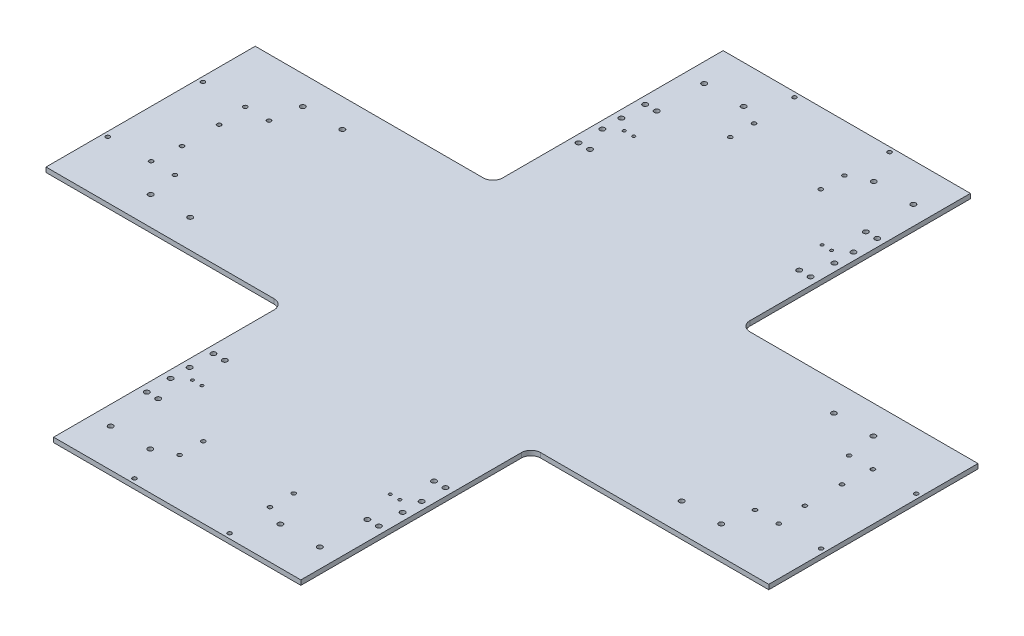
from build123d import *

# Parameters (mm, degrees)
BOSS_EXTRUDE1_DEPTH = 5
SKETCH2_R           = 2.125
CUT_EXTRUDE1_DEPTH  = 3
SKETCH4_R           = 2.6
SKETCH4_R_2         = 1.6
CUT_EXTRUDE3_DEPTH  = 10
SKETCH5_R           = 2.1
CUT_EXTRUDE4_DEPTH  = 10
FILLET1_R           = 10
SKETCH6_R           = 2.6
CUT_EXTRUDE5_DEPTH  = 10


with BuildPart() as part:
    # Sketch1 → Boss-Extrude1 (new body)
    with BuildSketch(Plane(origin=(0, 0, 0), x_dir=(1, 0, 0), z_dir=(0, 1, 0))):
        Polygon((130, 352), (-130, 352), (-130, 110), (-380, 110), (-380, -110), (-130, -110), (-130, -352), (130, -352), (130, -110), (380, -110), (380, 110), (130, 110), align=None)
    extrude(amount=BOSS_EXTRUDE1_DEPTH)

    # Sketch2 → Cut-Extrude1 (cut)
    with BuildSketch(Plane(origin=(0, 5, 0), x_dir=(1, 0, 0), z_dir=(0, 1, 0))):
        with Locations(Location((330, 49.5, 0), (0, 0, 270))):
            Circle(SKETCH2_R)
        with Locations(Location((305, 49.5, 0), (0, 0, 270))):
            Circle(SKETCH2_R)
        with Locations(Location((327.5, 19.5, 0), (0, 0, 270))):
            Circle(SKETCH2_R)
        with Locations(Location((327.5, -19.5, 0), (0, 0, 90))):
            Circle(SKETCH2_R)
        with Locations(Location((305, -49.5, 0), (0, 0, 90))):
            Circle(SKETCH2_R)
        with Locations(Location((330, -49.5, 0), (0, 0, 90))):
            Circle(SKETCH2_R)
        with Locations(Location((-330, -49.5, 0), (0, 0, 270))):
            Circle(SKETCH2_R)
        with Locations(Location((-305, -49.5, 0), (0, 0, 270))):
            Circle(SKETCH2_R)
        with Locations(Location((-327.5, -19.5, 0), (0, 0, 270))):
            Circle(SKETCH2_R)
        with Locations(Location((-327.5, 19.5, 0), (0, 0, 90))):
            Circle(SKETCH2_R)
        with Locations(Location((-305, 49.5, 0), (0, 0, 90))):
            Circle(SKETCH2_R)
        with Locations(Location((-330, 49.5, 0), (0, 0, 90))):
            Circle(SKETCH2_R)
        with Locations(Location((47.5, 302, 0), (0, 0, 270))):
            Circle(SKETCH2_R)
        with Locations(Location((47.5, 277, 0), (0, 0, 270))):
            Circle(SKETCH2_R)
        with Locations(Location((-47.5, 277, 0), (0, 0, 90))):
            Circle(SKETCH2_R)
        with Locations(Location((-47.5, 302, 0), (0, 0, 90))):
            Circle(SKETCH2_R)
        with Locations(Location((-47.5, -302, 0), (0, 0, 270))):
            Circle(SKETCH2_R)
        with Locations(Location((-47.5, -277, 0), (0, 0, 270))):
            Circle(SKETCH2_R)
        with Locations(Location((47.5, -277, 0), (0, 0, 90))):
            Circle(SKETCH2_R)
        with Locations(Location((47.5, -302, 0), (0, 0, 90))):
            Circle(SKETCH2_R)
    extrude(amount=-CUT_EXTRUDE1_DEPTH, mode=Mode.SUBTRACT)

    # Sketch4 → Cut-Extrude3 (cut)
    with BuildSketch(Plane(origin=(0, 5, 0), x_dir=(1, 0, 0), z_dir=(0, 1, 0))):
        with Locations(Location((-122, 192, 0), (0, 0, 270))):
            Circle(SKETCH4_R)
        with Locations(Location((-110, 192, 0), (0, 0, 270))):
            Circle(SKETCH4_R)
        with Locations(Location((-122, 217, 0), (0, 0, 270))):
            Circle(SKETCH4_R)
        with Locations(Location((-122, 237, 0), (0, 0, 270))):
            Circle(SKETCH4_R)
        with Locations(Location((-122, 262, 0), (0, 0, 270))):
            Circle(SKETCH4_R)
        with Locations(Location((-110, 262, 0), (0, 0, 270))):
            Circle(SKETCH4_R)
        with Locations(Location((110, 262, 0), (0, 0, 90))):
            Circle(SKETCH4_R)
        with Locations(Location((122, 262, 0), (0, 0, 90))):
            Circle(SKETCH4_R)
        with Locations(Location((122, 237, 0), (0, 0, 90))):
            Circle(SKETCH4_R)
        with Locations(Location((122, 217, 0), (0, 0, 90))):
            Circle(SKETCH4_R)
        with Locations(Location((110, 192, 0), (0, 0, 90))):
            Circle(SKETCH4_R)
        with Locations(Location((122, 192, 0), (0, 0, 90))):
            Circle(SKETCH4_R)
        with Locations(Location((122, -192, 0), (0, 0, 270))):
            Circle(SKETCH4_R)
        with Locations(Location((110, -192, 0), (0, 0, 270))):
            Circle(SKETCH4_R)
        with Locations(Location((122, -217, 0), (0, 0, 270))):
            Circle(SKETCH4_R)
        with Locations(Location((122, -237, 0), (0, 0, 270))):
            Circle(SKETCH4_R)
        with Locations(Location((122, -262, 0), (0, 0, 270))):
            Circle(SKETCH4_R)
        with Locations(Location((110, -262, 0), (0, 0, 270))):
            Circle(SKETCH4_R)
        with Locations(Location((-110, -262, 0), (0, 0, 90))):
            Circle(SKETCH4_R)
        with Locations(Location((-122, -262, 0), (0, 0, 90))):
            Circle(SKETCH4_R)
        with Locations(Location((-122, -237, 0), (0, 0, 90))):
            Circle(SKETCH4_R)
        with Locations(Location((-122, -217, 0), (0, 0, 90))):
            Circle(SKETCH4_R)
        with Locations(Location((-110, -192, 0), (0, 0, 90))):
            Circle(SKETCH4_R)
        with Locations(Location((-122, -192, 0), (0, 0, 90))):
            Circle(SKETCH4_R)
        with Locations(Location((109, -227, 0), (0, 0, 270))):
            Circle(SKETCH4_R_2)
        with Locations(Location((-109, -227, 0), (0, 0, 90))):
            Circle(SKETCH4_R_2)
        with Locations(Location((109, 227, 0), (0, 0, 90))):
            Circle(SKETCH4_R_2)
        with Locations(Location((-109, 227, 0), (0, 0, 270))):
            Circle(SKETCH4_R_2)
        with Locations(Location((99, -227, 0), (0, 0, 270))):
            Circle(SKETCH4_R_2)
        with Locations(Location((-99, -227, 0), (0, 0, 90))):
            Circle(SKETCH4_R_2)
        with Locations(Location((99, 227, 0), (0, 0, 90))):
            Circle(SKETCH4_R_2)
        with Locations(Location((-99, 227, 0), (0, 0, 270))):
            Circle(SKETCH4_R_2)
    extrude(amount=-CUT_EXTRUDE3_DEPTH, mode=Mode.SUBTRACT)

    # Sketch5 → Cut-Extrude4 (cut)
    with BuildSketch(Plane(origin=(0, 5, 0), x_dir=(1, 0, 0), z_dir=(0, 1, 0))):
        with Locations(Location((-50, 347, 0), (0, 0, 270))):
            Circle(SKETCH5_R)
        with Locations(Location((50, 347, 0), (0, 0, 270))):
            Circle(SKETCH5_R)
        with Locations(Location((50, -347, 0), (0, 0, 90))):
            Circle(SKETCH5_R)
        with Locations(Location((-50, -347, 0), (0, 0, 90))):
            Circle(SKETCH5_R)
        with Locations(Location((-375, 50, 0), (0, 0, 270))):
            Circle(SKETCH5_R)
        with Locations(Location((-375, -50, 0), (0, 0, 270))):
            Circle(SKETCH5_R)
        with Locations(Location((375, -50, 0), (0, 0, 90))):
            Circle(SKETCH5_R)
        with Locations(Location((375, 50, 0), (0, 0, 90))):
            Circle(SKETCH5_R)
    extrude(amount=-CUT_EXTRUDE4_DEPTH, mode=Mode.SUBTRACT)

    # Fillet1
    fillet1_edges = [part.edges().sort_by_distance(p)[0] for p in [
        (130, 2.5, -110),
        (130, 2.5, 110),
        (-130, 2.5, 110),
        (-130, 2.5, -110),
    ]]
    fillet(fillet1_edges, radius=FILLET1_R)

    # Sketch6 → Cut-Extrude5 (cut)
    with BuildSketch(Plane(origin=(0, 5, 0), x_dir=(1, 0, 0), z_dir=(0, 1, 0))):
        with Locations(Location((-110, 312, 0), (0, 0, 270))):
            Circle(SKETCH6_R)
        with Locations(Location((-68.4, 312, 0), (0, 0, 270))):
            Circle(SKETCH6_R)
        with Locations(Location((68.4, 312, 0), (0, 0, 90))):
            Circle(SKETCH6_R)
        with Locations(Location((110, 312, 0), (0, 0, 90))):
            Circle(SKETCH6_R)
        with Locations(Location((110, -312, 0), (0, 0, 270))):
            Circle(SKETCH6_R)
        with Locations(Location((68.4, -312, 0), (0, 0, 270))):
            Circle(SKETCH6_R)
        with Locations(Location((-68.4, -312, 0), (0, 0, 90))):
            Circle(SKETCH6_R)
        with Locations(Location((-110, -312, 0), (0, 0, 90))):
            Circle(SKETCH6_R)
        with Locations(Location((258.4, 80, 0), (0, 0, 270))):
            Circle(SKETCH6_R)
        with Locations(Location((300, 80, 0), (0, 0, 270))):
            Circle(SKETCH6_R)
        with Locations(Location((300, -80, 0), (0, 0, 90))):
            Circle(SKETCH6_R)
        with Locations(Location((258.4, -80, 0), (0, 0, 90))):
            Circle(SKETCH6_R)
        with Locations(Location((-258.4, -80, 0), (0, 0, 270))):
            Circle(SKETCH6_R)
        with Locations(Location((-300, -80, 0), (0, 0, 270))):
            Circle(SKETCH6_R)
        with Locations(Location((-300, 80, 0), (0, 0, 90))):
            Circle(SKETCH6_R)
        with Locations(Location((-258.4, 80, 0), (0, 0, 90))):
            Circle(SKETCH6_R)
    extrude(amount=-CUT_EXTRUDE5_DEPTH, mode=Mode.SUBTRACT)


solid = part.part
